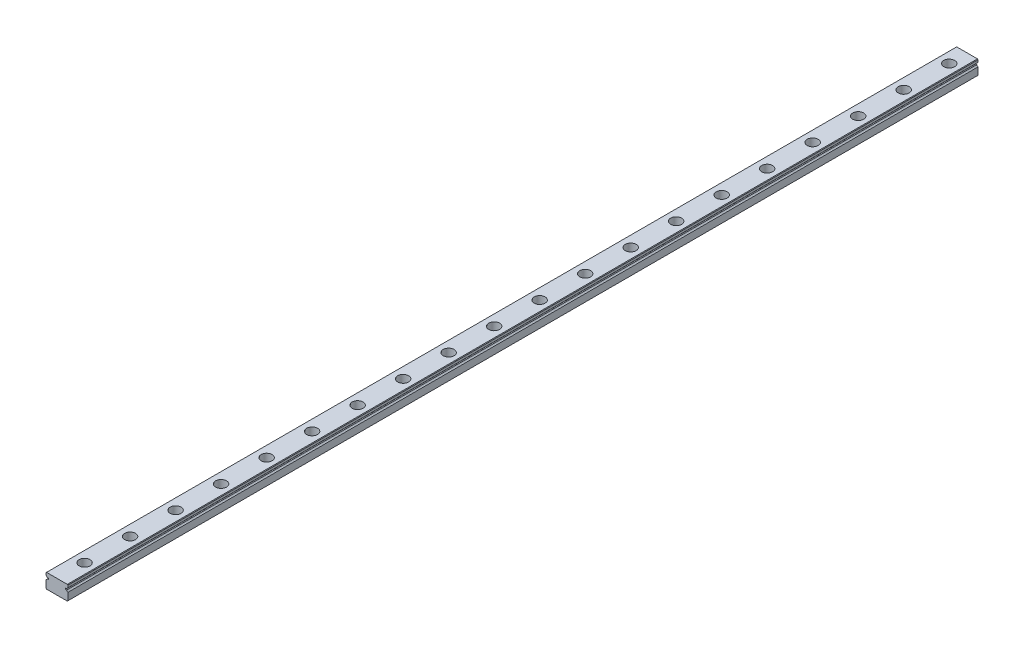
from build123d import *

# Parameters (mm, degrees)
EXTRUDE_1_DEPTH        = 500
SKETCH_2_R             = 3
SKETCH_2_R_2           = 1.75
CUT_EXTRUDE_1_DEPTH    = 4.5
SKETCH_2_2_R           = 1.75
CUT_EXTRUDE_2_DEPTH    = 501.099990002
PATTERN_LINEAR_1_COUNT = 20
PATTERN_LINEAR_1_PITCH = 25


with BuildPart() as part:
    # Эскиз1 → Бобышка-Вытянуть1 (new body)
    with BuildSketch(Plane.XY):
        with BuildLine():
            Line((-6, 3.7), (-5.7, 4))
            Line((-5.7, 4), (5.7, 4))
            Line((5.7, 4), (6, 3.7))
            Line((6, 3.7), (6, 2.449776022))
            ThreePointArc((6, 2.449776022), (5.561887715, 2.168810579), (5.297911886, 1.720256551))
            Line((5.297911886, 1.720256551), (4.687472904, 1.720256551))
            Line((4.687472904, 1.720256551), (4.687472904, 1.082255421))
            Line((4.687472904, 1.082255421), (5.292171789, 1.082255421))
            ThreePointArc((5.292171789, 1.082255421), (5.554928022, 0.621665058), (6, 0.333402583))
            Line((6, 0.333402583), (6, -3.7))
            Line((6, -3.7), (5.7, -4))
            Line((5.7, -4), (-5.7, -4))
            Line((-5.7, -4), (-6, -3.7))
            Line((-6, -3.7), (-6, 0.333402583))
            ThreePointArc((-6, 0.333402583), (-5.554928022, 0.621665058), (-5.292171789, 1.082255421))
            Line((-5.292171789, 1.082255421), (-4.687472904, 1.082255421))
            Line((-4.687472904, 1.082255421), (-4.687472904, 1.720256551))
            Line((-4.687472904, 1.720256551), (-5.297911886, 1.720256551))
            ThreePointArc((-5.297911886, 1.720256551), (-5.561887715, 2.168810579), (-6, 2.449776022))
            Line((-6, 2.449776022), (-6, 3.7))
        make_face()
    extrude(amount=EXTRUDE_1_DEPTH)

    # Эскиз2 → Вырез-Вытянуть1 (cut)
    with BuildSketch(Plane(origin=(0, 4, 0), x_dir=(1, 0, 0), z_dir=(0, 1, 0))):
        with Locations((0.188190244, -10)):
            Circle(SKETCH_2_R)
        with Locations((0.188190244, -10)):
            Circle(SKETCH_2_R_2, mode=Mode.SUBTRACT)
    cut_extrude_1 = extrude(amount=-CUT_EXTRUDE_1_DEPTH, mode=Mode.SUBTRACT)

    # Эскиз2<2> → Вырез-Вытянуть2 (cut, through all)
    with BuildSketch(Plane(origin=(0, 4, 0), x_dir=(1, 0, 0), z_dir=(0, 1, 0))):
        with Locations((0.188190244, -10)):
            Circle(SKETCH_2_2_R)
    cut_extrude_2 = extrude(amount=-CUT_EXTRUDE_2_DEPTH, mode=Mode.SUBTRACT)

    # Линейный массив1: Вырез-Вытянуть1, Вырез-Вытянуть2 ×20
    with Locations(*[(0, 0, i * PATTERN_LINEAR_1_PITCH) for i in range(1, PATTERN_LINEAR_1_COUNT)]):
        add(cut_extrude_1, mode=Mode.SUBTRACT)
        add(cut_extrude_2, mode=Mode.SUBTRACT)


solid = part.part
